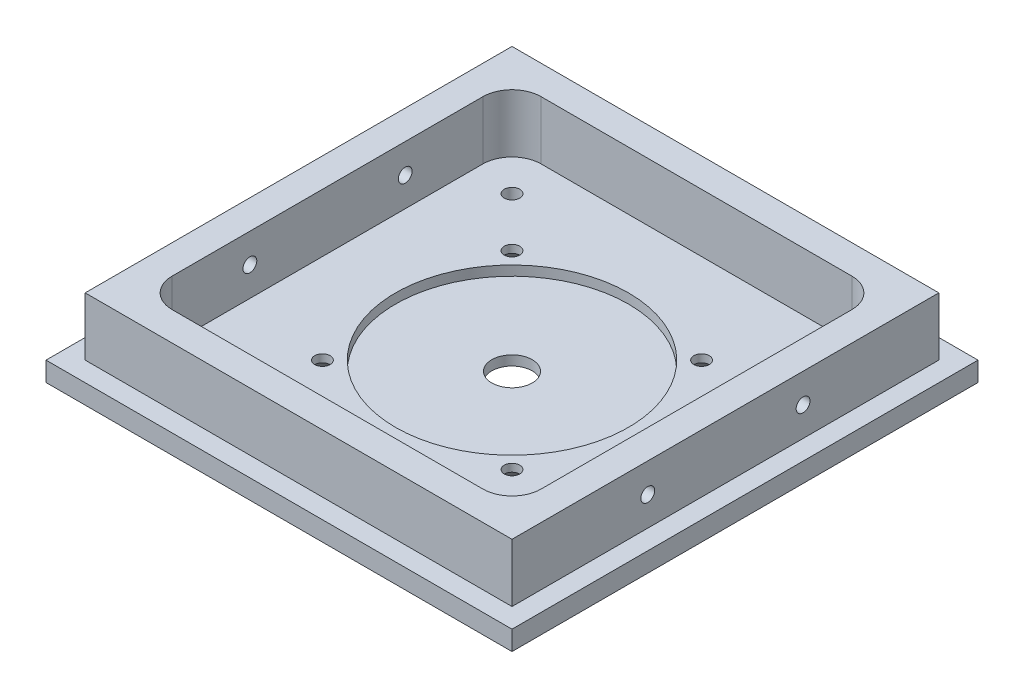
from build123d import *
from OCP.BRepFilletAPI import BRepFilletAPI_MakeChamfer

# Parameters (mm, degrees)
SKETCH1_W                    = 76.2
SKETCH1_H                    = 76.2
BOSS_EXTRUDE1_DEPTH          = 3.175
SKETCH2_W                    = 69.79412
SKETCH2_H                    = 69.79412
SKETCH2_W_2                  = 60.325
SKETCH2_H_2                  = 60.325
BOSS_EXTRUDE2_DEPTH          = 9.525
FILLET1_R                    = 4.7625
SKETCH3_R                    = 19.05
CUT_EXTRUDE1_DEPTH           = 1.5875
SKETCH4_R                    = 3.302
CUT_EXTRUDE2_DEPTH           = 56.015521957
F_39_0_0995_DIAMETER_HOLE1_D = 2.5273
CHAMFER1_SIZE                = 1.905
CHAMFER1_SIZE2               = 1.655991236


with BuildPart() as part:
    # Sketch1 → Boss-Extrude1 (new body)
    with BuildSketch(Plane(origin=(0, 0, 0), x_dir=(1, 0, 0), z_dir=(0, 1, 0))):
        Rectangle(SKETCH1_W, SKETCH1_H)
    extrude(amount=BOSS_EXTRUDE1_DEPTH)

    # Sketch2 → Boss-Extrude2 (add)
    with BuildSketch(Plane(origin=(0, 3.175, 0), x_dir=(1, 0, 0), z_dir=(0, 1, 0))):
        Rectangle(SKETCH2_W, SKETCH2_H)
        Rectangle(SKETCH2_W_2, SKETCH2_H_2, mode=Mode.SUBTRACT)
    extrude(amount=BOSS_EXTRUDE2_DEPTH)

    # Fillet1
    fillet1_edges = [part.edges().sort_by_distance(p)[0] for p in [
        (-30.1625, 7.9375, 30.1625),
        (30.1625, 7.9375, 30.1625),
        (30.1625, 7.9375, -30.1625),
        (-30.1625, 7.9375, -30.1625),
    ]]
    fillet(fillet1_edges, radius=FILLET1_R)

    # Sketch3 → Cut-Extrude1 (cut)
    with BuildSketch(Plane(origin=(0, 3.175, 0), x_dir=(1, 0, 0), z_dir=(0, 1, 0))):
        with Locations(Location((0, 0, 0), (0, 0, 270))):
            Circle(SKETCH3_R)
    extrude(amount=-CUT_EXTRUDE1_DEPTH, mode=Mode.SUBTRACT)

    # Sketch4 → Cut-Extrude2 (cut, through all)
    with BuildSketch(Plane(origin=(0, 1.5875, 0), x_dir=(1, 0, 0), z_dir=(0, 1, 0))):
        with Locations(Location((0, 0, 0), (0, 0, 270))):
            Circle(SKETCH4_R)
    extrude(amount=-CUT_EXTRUDE2_DEPTH, mode=Mode.SUBTRACT)

    # #39 (0.0995) Diameter Hole1 (through all)
    with Locations(Plane(origin=(0, 3.175, 0), x_dir=(1, 0, 0), z_dir=(0, 1, 0))):
        with Locations((15.5, 15.5), (-15.5, 15.5), (-15.5, -15.5), (15.5, -15.5), (-23.57, 23.57), (23.57, 23.57), (23.57, -23.57), (-23.57, -23.57)):
            Hole(F_39_0_0995_DIAMETER_HOLE1_D / 2)

    # Sketch9 → #4-40 Tapped Hole1 (revolve, cut)
    with BuildSketch(Plane(origin=(34.89706, 7.9375, 12.7), x_dir=(0, 0, -1), z_dir=(0, 1, 0))):
        Polygon((0, 0), (0, 7.283152758), (1.1303, 6.604), (1.1303, 0), align=None)
    f_4_40_tapped_hole1 = revolve(axis=Axis((41.24706, 7.9375, 12.7), (-1, 0, 0)), mode=Mode.SUBTRACT)

    # Mirror1: #4-40 Tapped Hole1 across plane
    add(f_4_40_tapped_hole1.mirror(Plane.XY), mode=Mode.SUBTRACT)

    # Mirror2: #4-40 Tapped Hole1 across plane
    add(f_4_40_tapped_hole1.mirror(Plane(origin=(0, 0, 0), x_dir=(0, 0, 1), z_dir=(1, 0, 0))), mode=Mode.SUBTRACT)

    # Mirror2 copy 1 sketch → Mirror2 copy 1 (revolve, cut)
    with BuildSketch(Plane(origin=(-34.89706, 7.9375, -12.7), x_dir=(0, 0, 1), z_dir=(0, 1, 0))):
        Polygon((0, 0), (0, 7.283152758), (1.1303, 6.604), (1.1303, 0), align=None)
    revolve(axis=Axis((-41.24706, 7.9375, -12.7), (1, 0, 0)), mode=Mode.SUBTRACT)

    # Chamfer1: one chamfer whose edges measure the first distance from different faces: ONE call of the kernel's chamfer builder (chamfer() names one face for all edges)
    chamfer1_edges_1 = [part.edges().sort_by_distance(p)[0] for p in [
        (16.76365, 0, 15.5),
    ]]
    chamfer1_side_1 = [part.faces().sort_by_distance(p)[0] for p in [
        (16.76365, 1.5875, 15.5),
    ]]
    chamfer1_edges_2 = [part.edges().sort_by_distance(p)[0] for p in [
        (-14.23635, 0, 15.5),
    ]]
    chamfer1_side_2 = [part.faces().sort_by_distance(p)[0] for p in [
        (-14.23635, 1.5875, 15.5),
    ]]
    chamfer1_edges_3 = [part.edges().sort_by_distance(p)[0] for p in [
        (-14.23635, 0, -15.5),
    ]]
    chamfer1_side_3 = [part.faces().sort_by_distance(p)[0] for p in [
        (-14.23635, 1.5875, -15.5),
    ]]
    chamfer1_edges_4 = [part.edges().sort_by_distance(p)[0] for p in [
        (16.76365, 0, -15.5),
    ]]
    chamfer1_side_4 = [part.faces().sort_by_distance(p)[0] for p in [
        (16.76365, 1.5875, -15.5),
    ]]
    chamfer1 = BRepFilletAPI_MakeChamfer(part.part.solid().wrapped)
    for e in chamfer1_edges_1:
        chamfer1.Add(CHAMFER1_SIZE, CHAMFER1_SIZE2, e.wrapped, chamfer1_side_1[0].wrapped)  # the first distance lies on this face
    for e in chamfer1_edges_2:
        chamfer1.Add(CHAMFER1_SIZE, CHAMFER1_SIZE2, e.wrapped, chamfer1_side_2[0].wrapped)  # the first distance lies on this face
    for e in chamfer1_edges_3:
        chamfer1.Add(CHAMFER1_SIZE, CHAMFER1_SIZE2, e.wrapped, chamfer1_side_3[0].wrapped)  # the first distance lies on this face
    for e in chamfer1_edges_4:
        chamfer1.Add(CHAMFER1_SIZE, CHAMFER1_SIZE2, e.wrapped, chamfer1_side_4[0].wrapped)  # the first distance lies on this face
    add(Compound.cast(chamfer1.Shape()), mode=Mode.REPLACE)


solid = part.part
